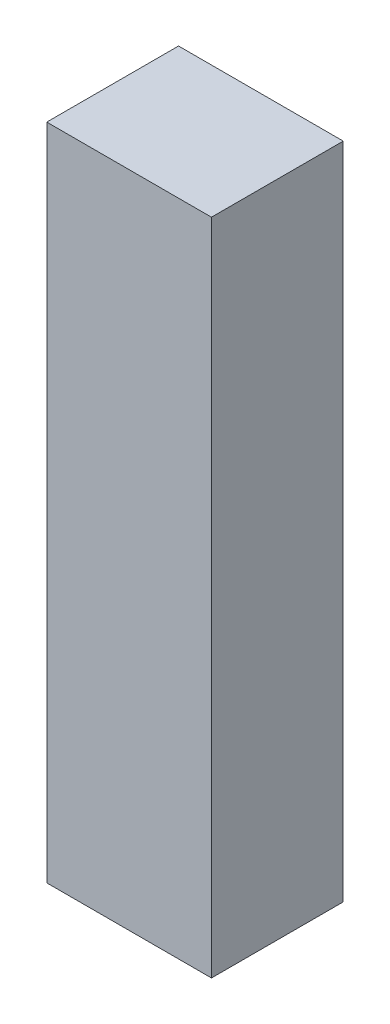
from build123d import *

# Parameters (mm, degrees)
TOPPING_ARKA_DUVAR_PANO_SURUCU_4_1_START = -736
SKETCH1_W                                = 50
SKETCH1_H                                = 200
TOPPING_ARKA_DUVAR_PANO_SURUCU_4_1_DEPTH = 40


with BuildPart() as part:
    # Sketch1 → TOPPING_arka_duvar_pano_surucu_4_1 (new body)
    with BuildSketch(Plane.XY.offset(TOPPING_ARKA_DUVAR_PANO_SURUCU_4_1_START)):
        with Locations((385, 430)):
            Rectangle(SKETCH1_W, SKETCH1_H)
    extrude(amount=-TOPPING_ARKA_DUVAR_PANO_SURUCU_4_1_DEPTH)


solid = part.part
